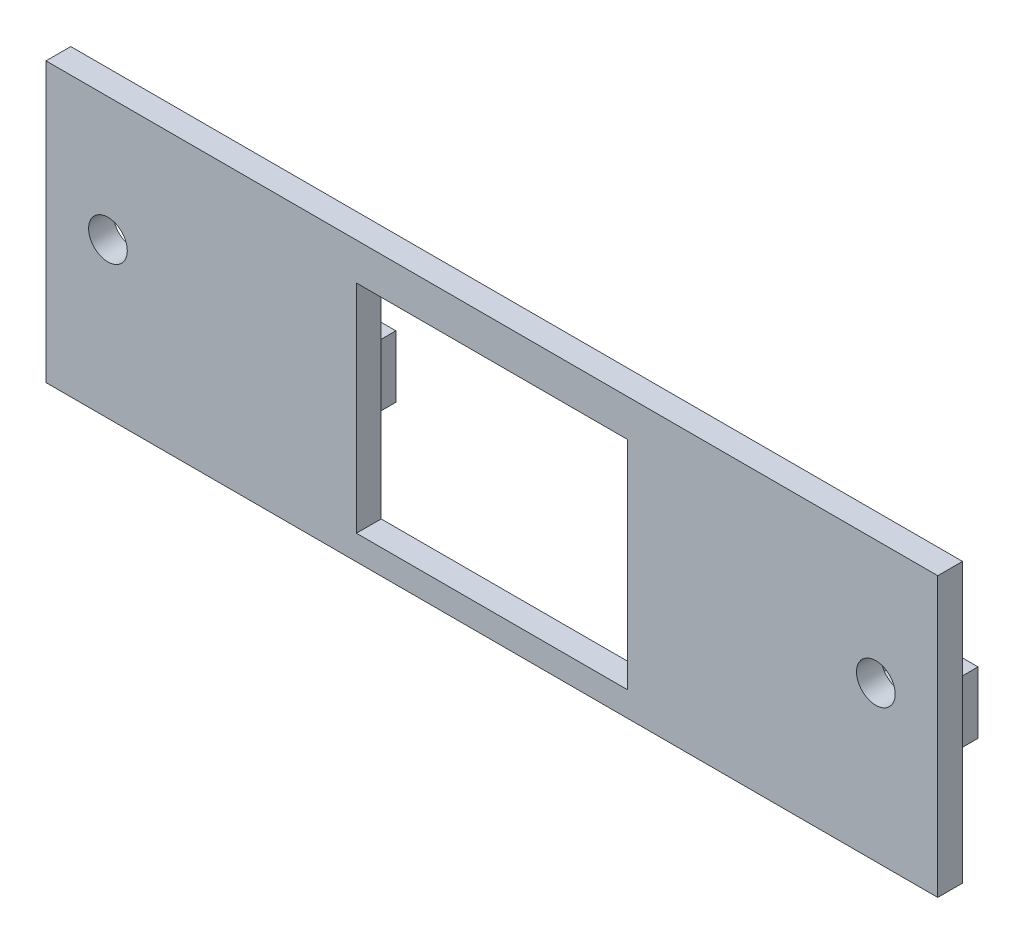
from build123d import *

# Parameters (mm, degrees)
SKETCH1_W               = 57.6
SKETCH1_H               = 18
SKETCH1_R               = 1.25
BOSS_EXTRUDE1_DEPTH     = 1.6
SKETCH7_W               = 8
SKETCH7_H               = 7
SKETCH7_R               = 1.3
BOSS_EXTRUDE3_DEPTH     = 4
BOSS_EXTRUDE3_2_DEPTH   = 4
CUT_EXTRUDE1_DEPTH      = 35.676216633
CUT_EXTRUDE1_DEPTH_BACK = 35.676216633
SKETCH8_W               = 17.5
SKETCH8_H               = 14
FILLET1_R               = 0.5


with BuildPart() as part:
    # Sketch1 → Boss-Extrude1 (new body)
    with BuildSketch(Plane.XY):
        with Locations((0, 9)):
            Rectangle(SKETCH1_W, SKETCH1_H)
        with Locations((-24.8, 10)):
            Circle(SKETCH1_R, mode=Mode.SUBTRACT)
        with Locations((24.8, 10)):
            Circle(SKETCH1_R, mode=Mode.SUBTRACT)
    extrude(amount=BOSS_EXTRUDE1_DEPTH)

    # Sketch8 → Cut-Extrude1 (cut, two sides: drawn at the far end of the back side and taken through both)
    with BuildSketch(Plane.XY.offset(-CUT_EXTRUDE1_DEPTH_BACK)):
        with Locations((0, 8.6)):
            Rectangle(SKETCH8_W, SKETCH8_H)
    extrude(amount=CUT_EXTRUDE1_DEPTH + CUT_EXTRUDE1_DEPTH_BACK, mode=Mode.SUBTRACT)


with BuildPart() as body_2:
    # Sketch7 → Boss-Extrude3 (new body)
    with BuildSketch(Plane(origin=(0, 1.6, 0), x_dir=(1, 0, 0), z_dir=(0, 1, 0))):
        with Locations((-18.8, 3.5)):
            Rectangle(SKETCH7_W, SKETCH7_H)
        with Locations((-18.8, 4.2)):
            Circle(SKETCH7_R, mode=Mode.SUBTRACT)
    extrude(amount=BOSS_EXTRUDE3_DEPTH)


with BuildPart() as body_3:
    # Sketch7 → Boss-Extrude3 2 (new body)
    with BuildSketch(Plane(origin=(0, 1.6, 0), x_dir=(1, 0, 0), z_dir=(0, 1, 0))):
        with Locations((18.8, 3.5)):
            Rectangle(SKETCH7_W, SKETCH7_H)
        with Locations((18.8, 4.2)):
            Circle(SKETCH7_R, mode=Mode.SUBTRACT)
    extrude(amount=BOSS_EXTRUDE3_2_DEPTH)


with BuildPart() as body_2_1:
    add(body_2.part)

    # Combine1: union part, body 3
    add(part.part)
    add(body_3.part)

    # Fillet1
    fillet1_edges = [body_2_1.edges().sort_by_distance(p)[0] for p in [
        (-14.8, 3.6, 0),
        (-22.8, 3.6, 0),
        (-18.8, 5.6, 0),
        (14.8, 3.6, 0),
        (22.8, 3.6, 0),
        (18.8, 5.6, 0),
    ]]
    fillet(fillet1_edges, radius=FILLET1_R)


solid = body_2_1.part
